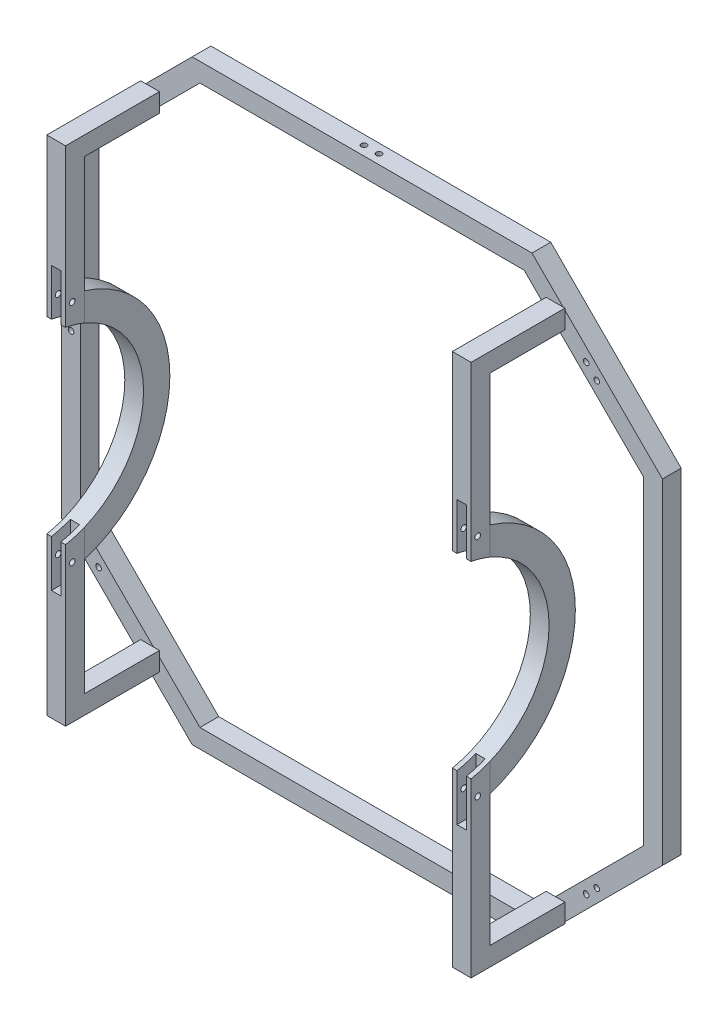
from build123d import *

# Parameters (mm, degrees)
Y_KSEKLIK_EKSTR_ZYON2_DEPTH = 10
IZIM3_W                     = 10
IZIM3_H                     = 40
Y_KSEKLIK_EKSTR_ZYON3_DEPTH = 10
IZIM4_W                     = 10
IZIM4_H                     = 133.89
Y_KSEKLIK_EKSTR_ZYON4_DEPTH = 10
IZIM6_W                     = 10
IZIM6_H                     = 50
Y_KSEKLIK_EKSTR_ZYON5_DEPTH = 10
IZIM7_W                     = 10
IZIM7_H                     = 142
Y_KSEKLIK_EKSTR_ZYON6_DEPTH = 10
IZIM8_R                     = 1.5
KES_EKSTR_ZYON1_DEPTH       = 35
IZIM9_R                     = 1.5
KES_EKSTR_ZYON2_DEPTH       = 374
IZIM12_R                    = 51
KES_EKSTR_ZYON4_DEPTH       = 338
Y_KSEKLIK_EKSTR_ZYON7_DEPTH = 5
Y_KSEKLIK_EKSTR_ZYON8_DEPTH = 5
IZIM21_W                    = 13.275114184
IZIM21_H                    = 150
KES_EKSTR_ZYON5_DEPTH       = 2.5
IZIM22_W                    = 15.470706389
IZIM22_H                    = 150
KES_EKSTR_ZYON6_DEPTH       = 2.5
IZIM23_R                    = 1.5
KES_EKSTR_ZYON7_DEPTH       = 242


with BuildPart() as part:
    # Çizim1 → Yükseklik-Ekstrüzyon2 (new body)
    with BuildSketch(Plane.XY):
        Polygon((-160, 89.142135624), (-90.502525317, 158.639610307), (90.502525317, 158.639610307), (160, 89.142135624), (160, -89.142135624), (90.502525317, -158.639610307), (-90.502525317, -158.639610307), (-160, -89.142135624), align=None)
        Polygon((-150, 85), (-150, -85), (-86.360389693, -148.639610307), (86.360389693, -148.639610307), (150, -85), (150, 85), (86.360389693, 148.639610307), (-86.360389693, 148.639610307), align=None, mode=Mode.SUBTRACT)
    extrude(amount=Y_KSEKLIK_EKSTR_ZYON2_DEPTH)

    # Çizim3 → Yükseklik-Ekstrüzyon3 (add)
    with BuildSketch(Plane(origin=(0, -123.89, 0), x_dir=(1, 0, 0), z_dir=(0, 1, 0))):
        with Locations((-112.926952731, -30)):
            Rectangle(IZIM3_W, IZIM3_H)
    y_kseklik_ekstr_zyon3 = extrude(amount=-Y_KSEKLIK_EKSTR_ZYON3_DEPTH)

    # Çizim4 → Yükseklik-Ekstrüzyon4 (add)
    with BuildSketch(Plane.XY.offset(50)):
        with Locations((-112.926952731, -66.945)):
            Rectangle(IZIM4_W, IZIM4_H)
    y_kseklik_ekstr_zyon4 = extrude(amount=Y_KSEKLIK_EKSTR_ZYON4_DEPTH)

    # Çizim6 → Yükseklik-Ekstrüzyon5 (add)
    with BuildSketch(Plane(origin=(0, -142, 0), x_dir=(1, 0, 0), z_dir=(0, 1, 0))):
        with Locations((103.073047269, -35)):
            Rectangle(IZIM6_W, IZIM6_H)
    y_kseklik_ekstr_zyon5 = extrude(amount=Y_KSEKLIK_EKSTR_ZYON5_DEPTH)

    # Çizim7 → Yükseklik-Ekstrüzyon6 (add)
    with BuildSketch(Plane.XY.offset(50)):
        with Locations((103.073047269, -71)):
            Rectangle(IZIM7_W, IZIM7_H)
    y_kseklik_ekstr_zyon6 = extrude(amount=Y_KSEKLIK_EKSTR_ZYON6_DEPTH)

    # Aynalama1: Yükseklik-Ekstrüzyon3, Yükseklik-Ekstrüzyon4, Yükseklik-Ekstrüzyon5, Yükseklik-Ekstrüzyon6 across plane
    add(y_kseklik_ekstr_zyon3.mirror(Plane.ZX))
    add(y_kseklik_ekstr_zyon4.mirror(Plane.ZX))
    add(y_kseklik_ekstr_zyon5.mirror(Plane.ZX))
    add(y_kseklik_ekstr_zyon6.mirror(Plane.ZX))

    # Çizim8 → Kes-Ekstrüzyon1 (cut)
    with BuildSketch(Plane.XY.offset(10)):
        with Locations((125, 117.071067812)):
            Circle(IZIM8_R)
        with Locations((119.343145751, 122.727922061)):
            Circle(IZIM8_R)
        with Locations((119.343145751, -122.727922061)):
            Circle(IZIM8_R)
        with Locations((125, -117.071067812)):
            Circle(IZIM8_R)
        with Locations((-140.343145751, 101.727922061)):
            Circle(IZIM8_R)
        with Locations((-146, 96.071067812)):
            Circle(IZIM8_R)
        with Locations((-140.343145751, -101.727922061)):
            Circle(IZIM8_R)
        with Locations((-146, -96.071067812)):
            Circle(IZIM8_R)
        with Locations((-155, 0)):
            Circle(IZIM8_R)
    extrude(amount=-KES_EKSTR_ZYON1_DEPTH, mode=Mode.SUBTRACT)

    # Çizim9 → Kes-Ekstrüzyon2 (cut)
    with BuildSketch(Plane(origin=(0, -142, 0), x_dir=(1, 0, 0), z_dir=(0, 1, 0))):
        with Locations(Location((-4, -4.992750184, 0), (0, 0, 90))):
            Circle(IZIM9_R)
        with Locations(Location((4, -4.992750184, 0), (0, 0, 90))):
            Circle(IZIM9_R)
    extrude(amount=KES_EKSTR_ZYON2_DEPTH, mode=Mode.SUBTRACT)

    # Çizim12 → Kes-Ekstrüzyon4 (cut, symmetric)
    with BuildSketch(Plane(origin=(-112.93, 0, 0), x_dir=(0, 0, -1), z_dir=(1, 0, 0))):
        with Locations((-69.443489697, 0)):
            Circle(IZIM12_R)
    extrude(amount=KES_EKSTR_ZYON4_DEPTH, both=True, mode=Mode.SUBTRACT)

    # Çizim19 → Yükseklik-Ekstrüzyon7 (add, symmetric)
    with BuildSketch(Plane(origin=(-112.93, 0, 0), x_dir=(0, 0, -1), z_dir=(1, 0, 0))):
        with BuildLine():
            Line((-50, -62.023791471), (-50, -47.148178209))
            ThreePointArc((-50, -47.148178209), (-18.443489697, 0), (-50, 47.148178209))
            Line((-50, 47.148178209), (-50, 62.023791471))
            ThreePointArc((-50, 62.023791471), (-4.443489697, 0), (-50, -62.023791471))
        make_face()
    extrude(amount=Y_KSEKLIK_EKSTR_ZYON7_DEPTH, both=True)

    # Çizim20 → Yükseklik-Ekstrüzyon8 (add, symmetric)
    with BuildSketch(Plane(origin=(103.07, 0, 0), x_dir=(0, 0, -1), z_dir=(1, 0, 0))):
        with BuildLine():
            Line((-50, -47.148178209), (-50, -62.023791471))
            ThreePointArc((-50, -62.023791471), (-4.443489697, 0), (-50, 62.023791471))
            Line((-50, 62.023791471), (-50, 47.148178209))
            ThreePointArc((-50, 47.148178209), (-18.443489697, 0), (-50, -47.148178209))
        make_face()
    extrude(amount=Y_KSEKLIK_EKSTR_ZYON8_DEPTH, both=True)

    # Çizim21 → Kes-Ekstrüzyon5 (cut, symmetric)
    with BuildSketch(Plane(origin=(-112.93, 0, 0), x_dir=(0, 0, -1), z_dir=(1, 0, 0))):
        with Locations((-56.637557092, 0)):
            Rectangle(IZIM21_W, IZIM21_H)
    extrude(amount=KES_EKSTR_ZYON5_DEPTH, both=True, mode=Mode.SUBTRACT)

    # Çizim22 → Kes-Ekstrüzyon6 (cut, symmetric)
    with BuildSketch(Plane(origin=(103.07, 0, 0), x_dir=(0, 0, -1), z_dir=(1, 0, 0))):
        with Locations((-57.735353195, 0)):
            Rectangle(IZIM22_W, IZIM22_H)
    extrude(amount=KES_EKSTR_ZYON6_DEPTH, both=True, mode=Mode.SUBTRACT)

    # Çizim23 → Kes-Ekstrüzyon7 (cut, symmetric)
    with BuildSketch(Plane(origin=(-112.93, 0, 0), x_dir=(0, 0, -1), z_dir=(1, 0, 0))):
        with Locations((-56.443489697, 60)):
            Circle(IZIM23_R)
        with Locations((-56.443489697, -60)):
            Circle(IZIM23_R)
    extrude(amount=KES_EKSTR_ZYON7_DEPTH, both=True, mode=Mode.SUBTRACT)


solid = part.part
